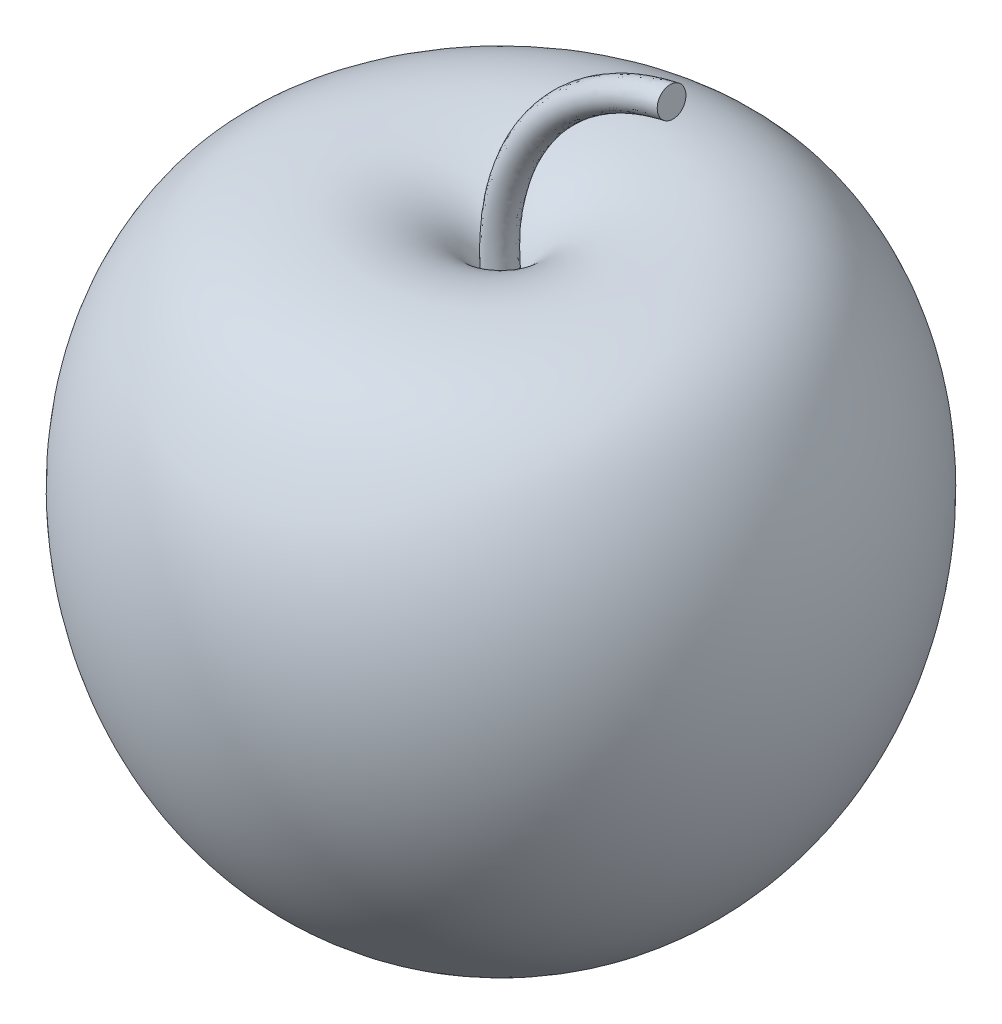
from build123d import *

# Parameters (mm, degrees)
IZIM3_R = 2


with BuildPart() as part:
    # Çizim1 → Döndür1 (revolve)
    with BuildSketch(Plane.XY):
        with BuildLine():
            Line((0, 0), (0, -75))
            add(Edge.make_bspline(
                [(-2, 0), (-5.793943173, 9.383525762), (-27.766007605, 11.227914309), (-57.131892537, -20.01149667), (-39.867778538, -75), (0, -75)],
                knots=[0, 0, 0, 0, 0.180102704, 0.280102704, 1, 1, 1, 1], degree=3))
            Line((-2, 0), (0, 0))
        make_face()
    revolve(axis=Axis((0, 0, 0), (0, -1, 0)))


with BuildPart() as body_2:
    # Süpür1: sweep along a path in Çizim2
    with BuildLine(Plane.XY) as s_p_r1_path:
        ThreePointArc((0, 0), (5.535772425, 21.248625635), (23.878590005, 33.318833212))
    # Çizim3 → Süpür1 (sweep)
    with BuildSketch(Plane(origin=(0, 0, 0), x_dir=(1, 0, 0), z_dir=(0, 1, 0))):
        Circle(IZIM3_R)
    sweep(path=s_p_r1_path.line)


solid = Compound([part.part, body_2.part])
